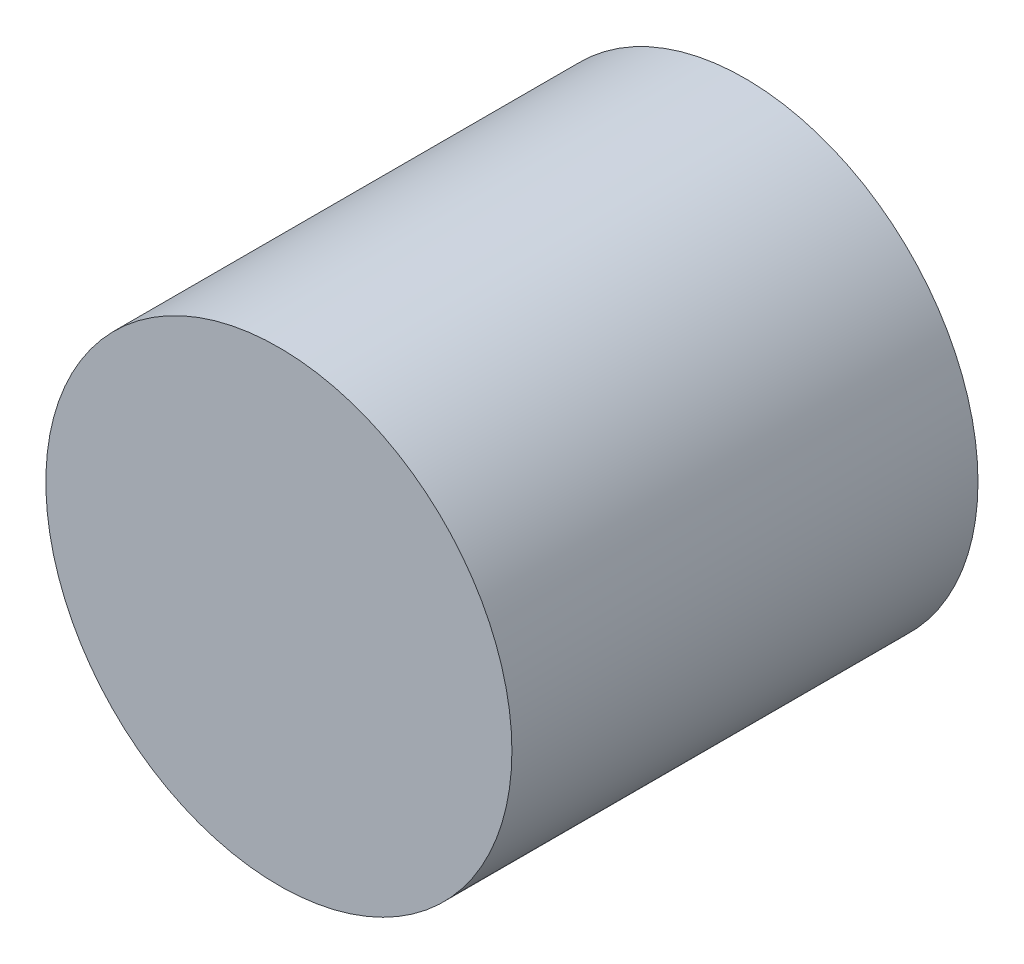
from build123d import *

# Parameters (mm, degrees)
SKETCH1_R           = 35
BOSS_EXTRUDE1_DEPTH = 70


with BuildPart() as part:
    # Sketch1 → Boss-Extrude1 (new body)
    with BuildSketch(Plane.XY):
        Circle(SKETCH1_R)
    extrude(amount=BOSS_EXTRUDE1_DEPTH)


solid = part.part
